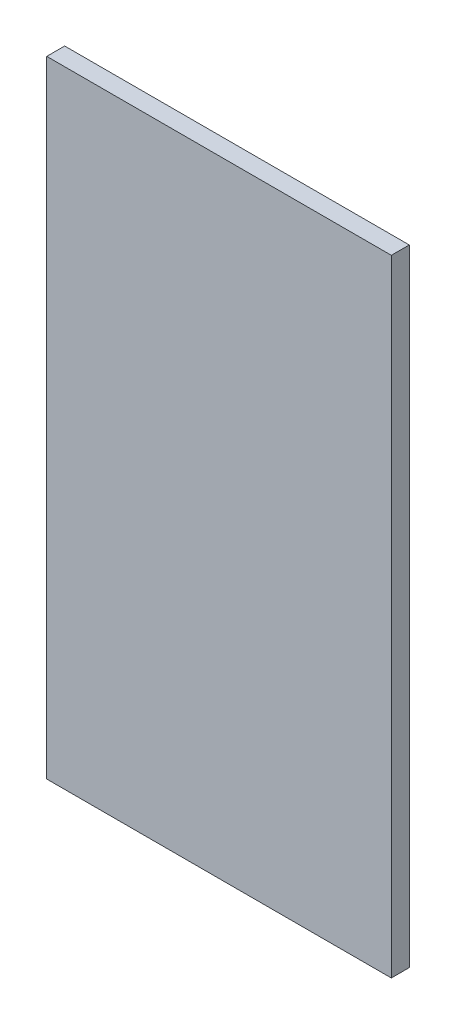
from build123d import *

# Parameters (mm, degrees)
SKETCH_1_W      = 980
SKETCH_1_H      = 1780
EXTRUDE_1_DEPTH = 25.5


with BuildPart() as part:
    # Эскиз1 → Бобышка-Вытянуть1 (new, symmetric)
    with BuildSketch(Plane.XY):
        Rectangle(SKETCH_1_W, SKETCH_1_H)
    extrude(amount=EXTRUDE_1_DEPTH, both=True)


solid = part.part
